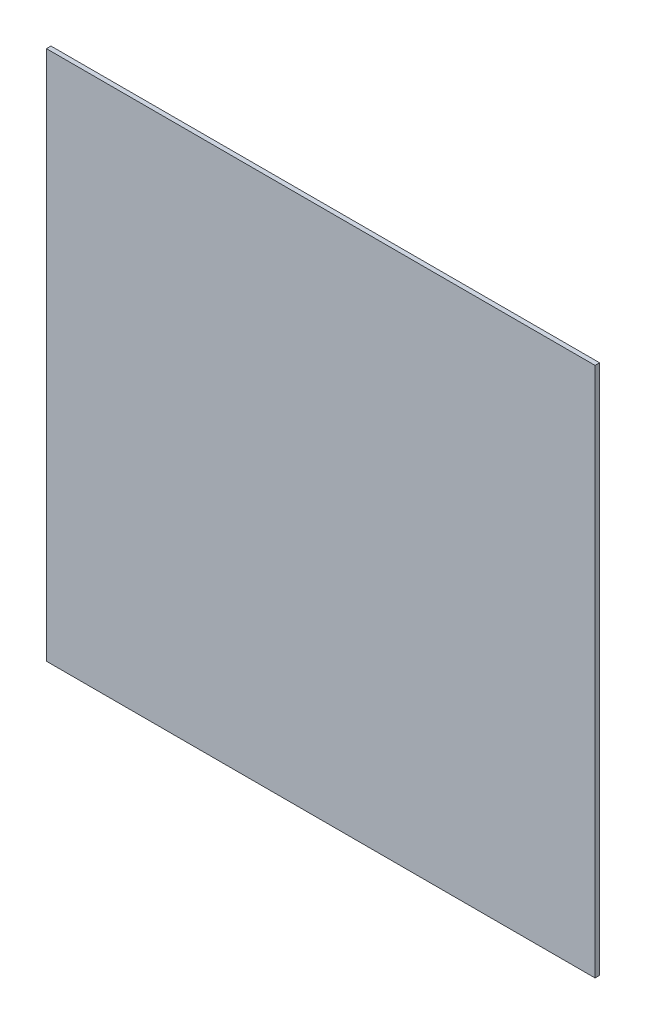
from build123d import *

# Parameters (mm, degrees)
ESQUISSE1_W        = 605
ESQUISSE1_H        = 585
BOSS_EXTRU_1_DEPTH = 5


with BuildPart() as part:
    # Esquisse1 → Boss.-Extru.1 (new body)
    with BuildSketch(Plane.XY):
        Rectangle(ESQUISSE1_W, ESQUISSE1_H)
    extrude(amount=BOSS_EXTRU_1_DEPTH)


solid = part.part
